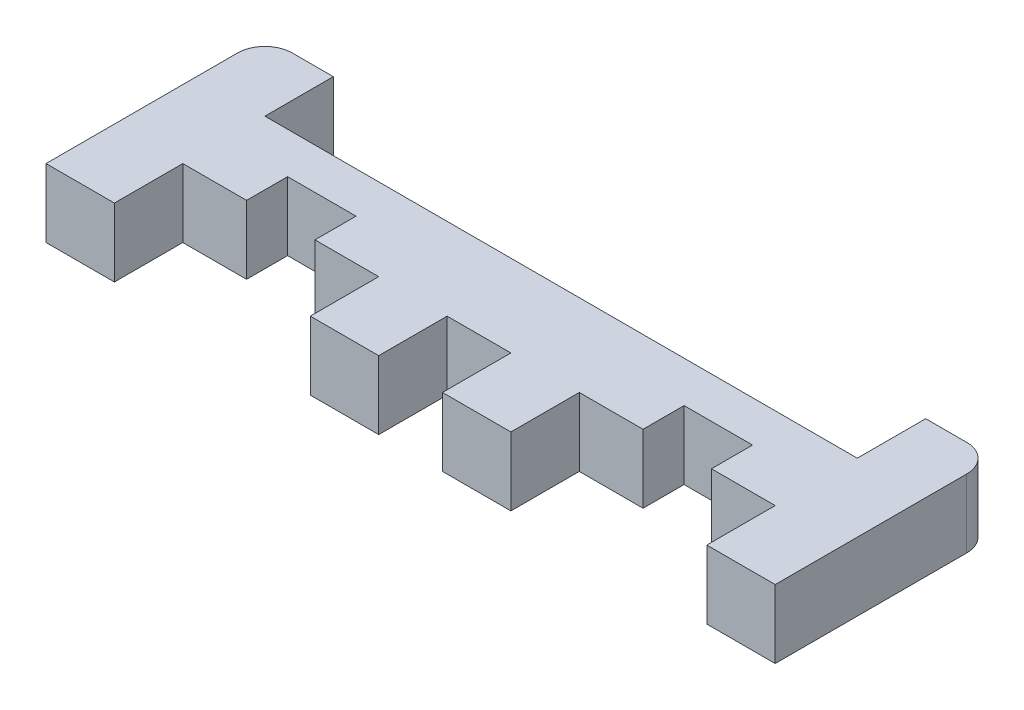
from build123d import *

# Parameters (mm, degrees)
BOSS_EXTRUDE1_DEPTH = 6.35


with BuildPart() as part:
    # Sketch1 → Boss-Extrude1 (new body)
    with BuildSketch(Plane(origin=(0, 0, 0), x_dir=(1, 0, 0), z_dir=(0, 1, 0))):
        with BuildLine():
            Line((-24.3205, 0), (24.3205, 0))
            Line((24.3205, 0), (27.4955, 0))
            Line((27.4955, 0), (27.4955, 6.35))
            Line((27.4955, 6.35), (31.3055, 6.35))
            ThreePointArc((31.3055, 6.35), (33.101551224, 5.606051224), (33.8455, 3.81))
            Line((33.8455, 3.81), (33.8455, -13.97))
            Line((33.8455, -13.97), (27.4955, -13.97))
            Line((27.4955, -13.97), (27.4955, -7.62))
            Line((27.4955, -7.62), (21.5773, -7.62))
            Line((21.5773, -7.62), (21.5773, -3.81))
            Line((21.5773, -3.81), (15.2273, -3.81))
            Line((15.2273, -3.81), (15.2273, -7.62))
            Line((15.2273, -7.62), (9.3091, -7.62))
            Line((9.3091, -7.62), (9.3091, -13.97))
            Line((9.3091, -13.97), (2.9591, -13.97))
            Line((2.9591, -13.97), (2.9591, -7.62))
            Line((2.9591, -7.62), (-2.9591, -7.62))
            Line((-2.9591, -7.62), (-2.9591, -13.97))
            Line((-2.9591, -13.97), (-9.3091, -13.97))
            Line((-9.3091, -13.97), (-9.3091, -7.62))
            Line((-9.3091, -7.62), (-15.2273, -7.62))
            Line((-15.2273, -7.62), (-15.2273, -3.81))
            Line((-15.2273, -3.81), (-21.5773, -3.81))
            Line((-21.5773, -3.81), (-21.5773, -7.62))
            Line((-21.5773, -7.62), (-27.4955, -7.62))
            Line((-27.4955, -7.62), (-27.4955, -13.97))
            Line((-27.4955, -13.97), (-33.8455, -13.97))
            Line((-33.8455, -13.97), (-33.8455, -7.62))
            Line((-33.8455, -7.62), (-33.8455, 3.81))
            ThreePointArc((-33.8455, 3.81), (-33.101551224, 5.606051224), (-31.3055, 6.35))
            Line((-31.3055, 6.35), (-27.4955, 6.35))
            Line((-27.4955, 6.35), (-27.4955, 0))
            Line((-27.4955, 0), (-24.3205, 0))
        make_face()
    extrude(amount=BOSS_EXTRUDE1_DEPTH)


solid = part.part
